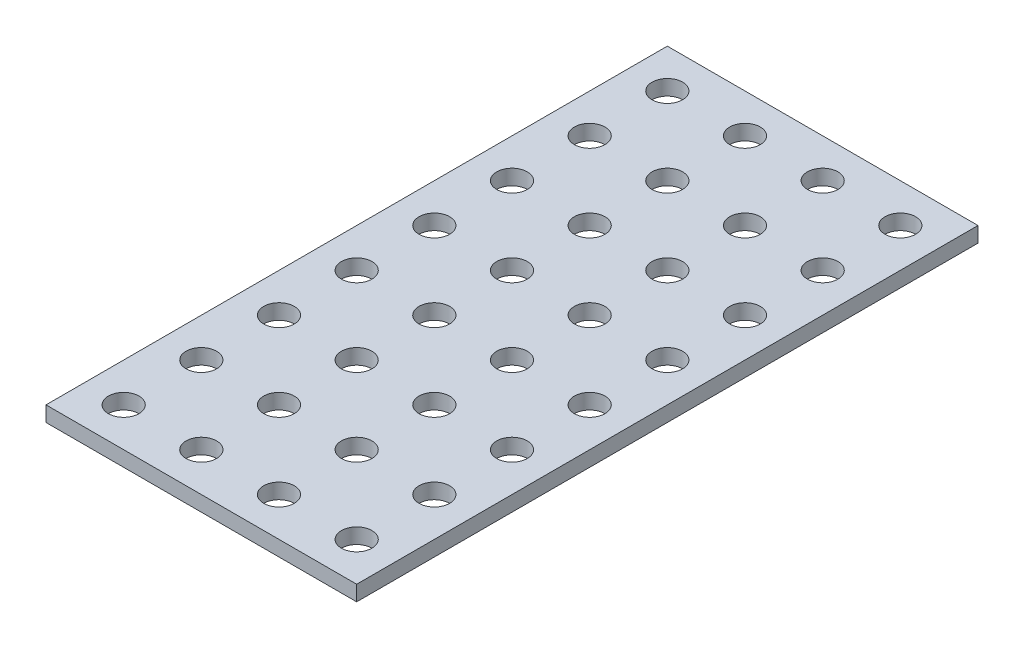
from build123d import *

# Parameters (mm, degrees)
SKETCH1_W           = 10.16
SKETCH1_H           = 20.32
SKETCH1_R           = 0.5
BOSS_EXTRUDE1_DEPTH = 0.5


with BuildPart() as part:
    # Sketch1 → Boss-Extrude1 (new body)
    with BuildSketch(Plane(origin=(0, 0, 0), x_dir=(1, 0, 0), z_dir=(0, 1, 0))):
        with Locations((3.81, 8.89)):
            Rectangle(SKETCH1_W, SKETCH1_H)
        with Locations(Location((0, 0, 0), (0, 0, 270))):
            Circle(SKETCH1_R, mode=Mode.SUBTRACT)
        with Locations(Location((2.54, 0, 0), (0, 0, 270))):
            Circle(SKETCH1_R, mode=Mode.SUBTRACT)
        with Locations(Location((5.08, 0, 0), (0, 0, 270))):
            Circle(SKETCH1_R, mode=Mode.SUBTRACT)
        with Locations(Location((7.62, 0, 0), (0, 0, 270))):
            Circle(SKETCH1_R, mode=Mode.SUBTRACT)
        with Locations(Location((2.54, 2.54, 0), (0, 0, 270))):
            Circle(SKETCH1_R, mode=Mode.SUBTRACT)
        with Locations(Location((5.08, 2.54, 0), (0, 0, 270))):
            Circle(SKETCH1_R, mode=Mode.SUBTRACT)
        with Locations(Location((7.62, 2.54, 0), (0, 0, 270))):
            Circle(SKETCH1_R, mode=Mode.SUBTRACT)
        with Locations(Location((2.54, 5.08, 0), (0, 0, 270))):
            Circle(SKETCH1_R, mode=Mode.SUBTRACT)
        with Locations(Location((5.08, 5.08, 0), (0, 0, 270))):
            Circle(SKETCH1_R, mode=Mode.SUBTRACT)
        with Locations(Location((7.62, 5.08, 0), (0, 0, 270))):
            Circle(SKETCH1_R, mode=Mode.SUBTRACT)
        with Locations(Location((2.54, 7.62, 0), (0, 0, 270))):
            Circle(SKETCH1_R, mode=Mode.SUBTRACT)
        with Locations(Location((5.08, 7.62, 0), (0, 0, 270))):
            Circle(SKETCH1_R, mode=Mode.SUBTRACT)
        with Locations(Location((7.62, 7.62, 0), (0, 0, 270))):
            Circle(SKETCH1_R, mode=Mode.SUBTRACT)
        with Locations(Location((2.54, 10.16, 0), (0, 0, 270))):
            Circle(SKETCH1_R, mode=Mode.SUBTRACT)
        with Locations(Location((5.08, 10.16, 0), (0, 0, 270))):
            Circle(SKETCH1_R, mode=Mode.SUBTRACT)
        with Locations(Location((7.62, 10.16, 0), (0, 0, 270))):
            Circle(SKETCH1_R, mode=Mode.SUBTRACT)
        with Locations(Location((2.54, 12.7, 0), (0, 0, 270))):
            Circle(SKETCH1_R, mode=Mode.SUBTRACT)
        with Locations(Location((5.08, 12.7, 0), (0, 0, 270))):
            Circle(SKETCH1_R, mode=Mode.SUBTRACT)
        with Locations(Location((7.62, 12.7, 0), (0, 0, 270))):
            Circle(SKETCH1_R, mode=Mode.SUBTRACT)
        with Locations(Location((2.54, 15.24, 0), (0, 0, 270))):
            Circle(SKETCH1_R, mode=Mode.SUBTRACT)
        with Locations(Location((5.08, 15.24, 0), (0, 0, 270))):
            Circle(SKETCH1_R, mode=Mode.SUBTRACT)
        with Locations(Location((7.62, 15.24, 0), (0, 0, 270))):
            Circle(SKETCH1_R, mode=Mode.SUBTRACT)
        with Locations(Location((2.54, 17.78, 0), (0, 0, 270))):
            Circle(SKETCH1_R, mode=Mode.SUBTRACT)
        with Locations(Location((5.08, 17.78, 0), (0, 0, 270))):
            Circle(SKETCH1_R, mode=Mode.SUBTRACT)
        with Locations(Location((7.62, 17.78, 0), (0, 0, 270))):
            Circle(SKETCH1_R, mode=Mode.SUBTRACT)
        with Locations(Location((0, 2.54, 0), (0, 0, 270))):
            Circle(SKETCH1_R, mode=Mode.SUBTRACT)
        with Locations(Location((0, 5.08, 0), (0, 0, 270))):
            Circle(SKETCH1_R, mode=Mode.SUBTRACT)
        with Locations(Location((0, 7.62, 0), (0, 0, 270))):
            Circle(SKETCH1_R, mode=Mode.SUBTRACT)
        with Locations(Location((0, 10.16, 0), (0, 0, 270))):
            Circle(SKETCH1_R, mode=Mode.SUBTRACT)
        with Locations(Location((0, 12.7, 0), (0, 0, 270))):
            Circle(SKETCH1_R, mode=Mode.SUBTRACT)
        with Locations(Location((0, 15.24, 0), (0, 0, 270))):
            Circle(SKETCH1_R, mode=Mode.SUBTRACT)
        with Locations(Location((0, 17.78, 0), (0, 0, 270))):
            Circle(SKETCH1_R, mode=Mode.SUBTRACT)
    extrude(amount=BOSS_EXTRUDE1_DEPTH)


solid = part.part
